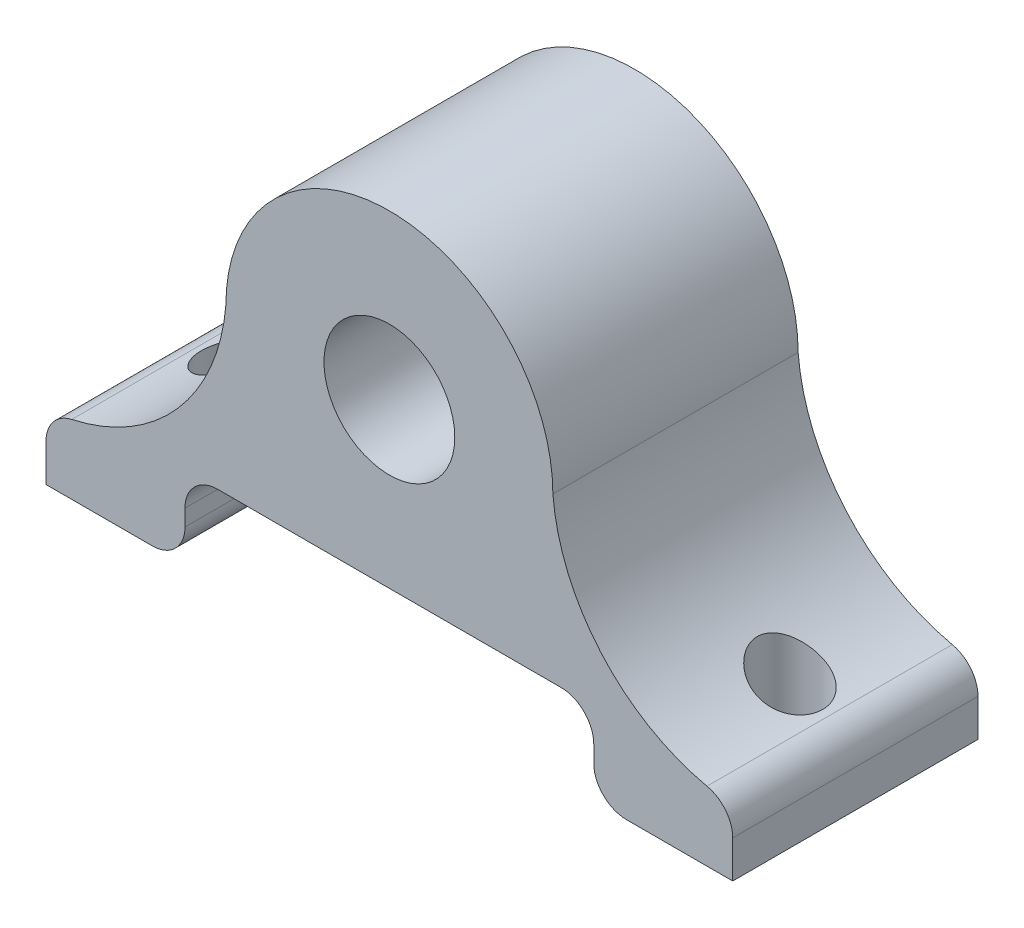
from build123d import *

# Parameters (mm, degrees)
BOSS_EXTRUDE1_DEPTH     = 15
CUT_EXTRUDE1_DEPTH      = 32.180923655
CUT_EXTRUDE1_DEPTH_BACK = 32.180923655
SKETCH2_R               = 4
CUT_EXTRUDE2_DEPTH      = 32.180923655
CUT_EXTRUDE2_DEPTH_BACK = 32.180923655
CUT_EXTRUDE3_DEPTH      = 36.930488446
CUT_EXTRUDE3_DEPTH_BACK = 36.930488446
SKETCH5_R               = 2
CUT_EXTRUDE4_DEPTH      = 36.930488547
CUT_EXTRUDE4_DEPTH_BACK = 5
SKETCH7_W               = 25
SKETCH7_H               = 15
FILLET1_R               = 2


with BuildPart() as part:
    # Sketch1 → Boss-Extrude1 (new body)
    with BuildSketch(Plane.XY):
        with BuildLine():
            Line((-21, -7.5), (21, -7.5))
            Line((21, -7.5), (21, 7.5))
            Line((21, 7.5), (10, 7.5))
            ThreePointArc((10, 7.5), (0, 17.5), (-10, 7.5))
            Line((-10, 7.5), (-21, 7.5))
            Line((-21, 7.5), (-21, -7.5))
        make_face()
    extrude(amount=BOSS_EXTRUDE1_DEPTH)

    # Sketch2 → Cut-Extrude1 (cut, two sides: drawn at the far end of the back side and taken through both)
    with BuildSketch(Plane.XY.offset(15).offset(-CUT_EXTRUDE1_DEPTH_BACK)):
        with Locations((0, 7.5)):
            Circle(SKETCH2_R)
    extrude(amount=CUT_EXTRUDE1_DEPTH + CUT_EXTRUDE1_DEPTH_BACK, mode=Mode.SUBTRACT)

    # Sketch4 → Cut-Extrude2 (cut, two sides: drawn at the far end of the back side and taken through both)
    with BuildSketch(Plane.XY.offset(15).offset(-CUT_EXTRUDE2_DEPTH_BACK)):
        with BuildLine():
            ThreePointArc((-21, -3.5), (-13.484032178, -0.015967822), (-10, 7.5))
            Line((-10, 7.5), (-21, 7.5))
            Line((-21, 7.5), (-21, -3.5))
        make_face()
        with BuildLine():
            Line((21, 7.5), (10, 7.5))
            ThreePointArc((10, 7.5), (13.484032178, -0.015967822), (21, -3.5))
            Line((21, -3.5), (21, 7.5))
        make_face()
    extrude(amount=CUT_EXTRUDE2_DEPTH + CUT_EXTRUDE2_DEPTH_BACK, mode=Mode.SUBTRACT)

    # Sketch5 → Cut-Extrude3 (cut, two sides: drawn at the far end of the back side and taken through both)
    with BuildSketch(Plane.XZ.offset(7.5).offset(-CUT_EXTRUDE3_DEPTH_BACK)):
        with Locations(Location((-17, 7.5, 0), (0, 0, 270))):
            Circle(SKETCH5_R)
        with Locations(Location((17, 7.5, 0), (0, 0, 270))):
            Circle(SKETCH5_R)
    extrude(amount=CUT_EXTRUDE3_DEPTH + CUT_EXTRUDE3_DEPTH_BACK, mode=Mode.SUBTRACT)

    # Sketch7 → Cut-Extrude4 (cut, two sides: drawn at the far end of the back side and taken through both)
    with BuildSketch(Plane.XZ.offset(7.5).offset(-CUT_EXTRUDE4_DEPTH_BACK)):
        with Locations((0, 7.5)):
            Rectangle(SKETCH7_W, SKETCH7_H)
    extrude(amount=CUT_EXTRUDE4_DEPTH + CUT_EXTRUDE4_DEPTH_BACK, mode=Mode.SUBTRACT)

    # Fillet1
    fillet1_edges = [part.edges().sort_by_distance(p)[0] for p in [
        (-21, -3.5, 7.5),
        (21, -3.5, 7.5),
        (12.5, -2.5, 7.5),
        (-12.5, -2.5, 7.5),
        (12.5, -7.5, 7.5),
        (-12.5, -7.5, 7.5),
    ]]
    fillet(fillet1_edges, radius=FILLET1_R)


solid = part.part
